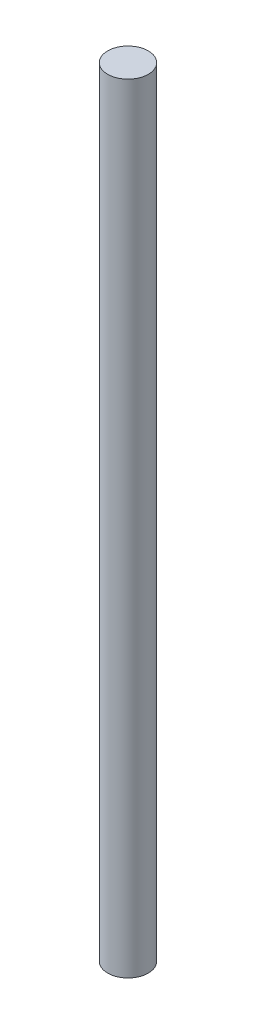
from build123d import *

# Parameters (mm, degrees)
SKETCH1_R           = 6
BOSS_EXTRUDE1_DEPTH = 230


with BuildPart() as part:
    # Sketch1 → Boss-Extrude1 (new body)
    with BuildSketch(Plane(origin=(0, 0, 0), x_dir=(1, 0, 0), z_dir=(0, 1, 0))):
        with Locations(Location((0, 0, 0), (0, 0, 270))):
            Circle(SKETCH1_R)
    extrude(amount=BOSS_EXTRUDE1_DEPTH)


solid = part.part
